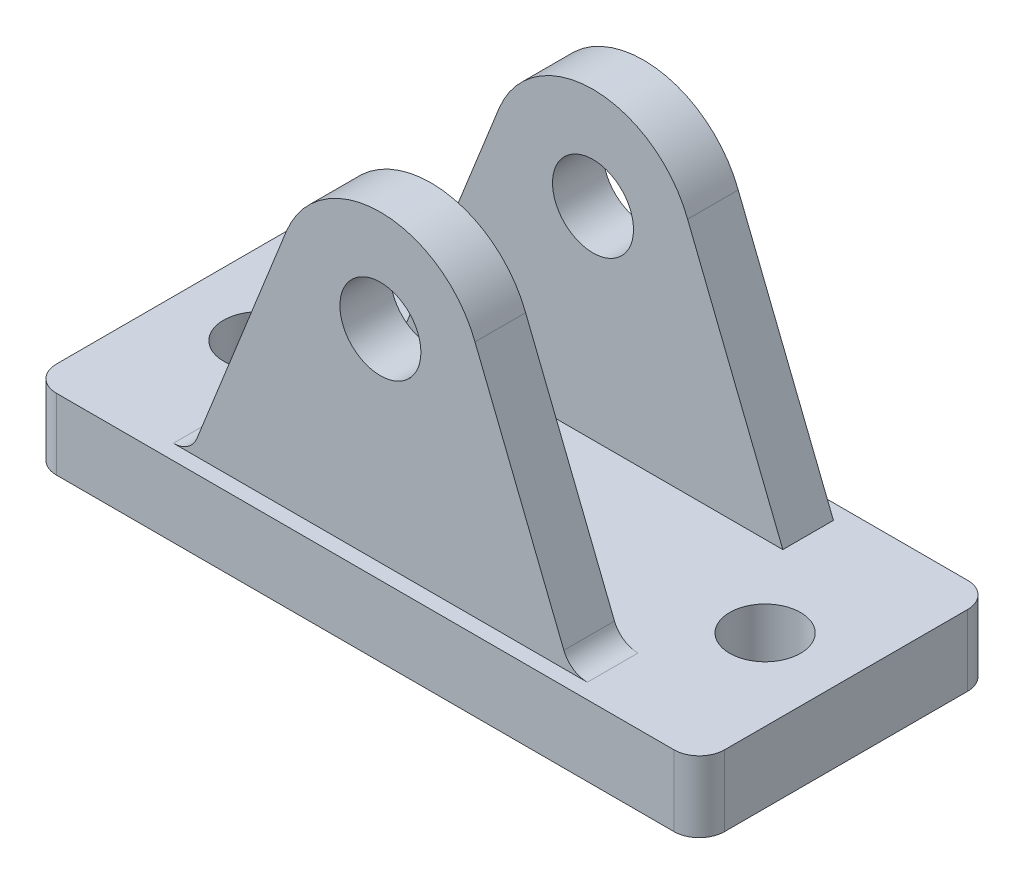
from build123d import *

# Parameters (mm, degrees)
IZIM1_R                     = 7
Y_KSEKLIK_EKSTR_ZYON1_DEPTH = 14
Y_KSEKLIK_EKSTR_ZYON3_START = -3
IZIM5_R                     = 8
Y_KSEKLIK_EKSTR_ZYON3_DEPTH = 10
RADYUS1_R                   = 5
L_O_ALTMA1_COUNT            = 2
L_O_ALTMA1_PITCH            = 42


with BuildPart() as part:
    # Çizim1 → Yükseklik-Ekstrüzyon1 (new body)
    with BuildSketch(Plane(origin=(0, 0, 0), x_dir=(1, 0, 0), z_dir=(0, 1, 0))):
        with BuildLine():
            Line((-135.225806452, 45.403225806), (-13.225806452, 45.403225806))
            ThreePointArc((-13.225806452, 45.403225806), (-9.690272546, 43.938759712), (-8.225806452, 40.403225806))
            Line((-8.225806452, 40.403225806), (-8.225806452, -7.596774194))
            ThreePointArc((-8.225806452, -7.596774194), (-9.690272546, -11.132308099), (-13.225806452, -12.596774194))
            Line((-13.225806452, -12.596774194), (-135.225806452, -12.596774194))
            ThreePointArc((-135.225806452, -12.596774194), (-138.761340358, -11.132308099), (-140.225806452, -7.596774194))
            Line((-140.225806452, -7.596774194), (-140.225806452, 40.403225806))
            ThreePointArc((-140.225806452, 40.403225806), (-138.761340358, 43.938759712), (-135.225806452, 45.403225806))
        make_face()
        with Locations(Location((-124.225806452, 16.403225806, 0), (0, 0, 270))):
            Circle(IZIM1_R, mode=Mode.SUBTRACT)
        with Locations(Location((-24.225806452, 16.403225806, 0), (0, 0, 270))):
            Circle(IZIM1_R, mode=Mode.SUBTRACT)
    extrude(amount=Y_KSEKLIK_EKSTR_ZYON1_DEPTH)

    # Çizim5 → Yükseklik-Ekstrüzyon3 (add)
    with BuildSketch(Plane.XY.offset(12.596774194).offset(Y_KSEKLIK_EKSTR_ZYON3_START)):
        with BuildLine():
            ThreePointArc((-55.536681856, 61.121560352), (-74.068812399, 73.999383812), (-92.800827063, 61.414081823))
            Line((-92.800827063, 61.414081823), (-111.725806452, 14))
            Line((-111.725806452, 14), (-36.725806452, 14))
            Line((-36.725806452, 14), (-55.536681856, 61.121560352))
        make_face()
        with Locations((-74.225806452, 54)):
            Circle(IZIM5_R, mode=Mode.SUBTRACT)
    y_kseklik_ekstr_zyon3 = extrude(amount=-Y_KSEKLIK_EKSTR_ZYON3_DEPTH)

    # Radyus1
    radyus1_edges = [part.edges().sort_by_distance(p)[0] for p in [
        (-36.725806452, 14, 4.596774194),
        (-111.725806452, 14, 4.596774194),
    ]]
    fillet(radyus1_edges, radius=RADYUS1_R)

    # LÇoğaltma1: Yükseklik-Ekstrüzyon3 ×2
    with Locations(*[(0, 0, -i * L_O_ALTMA1_PITCH) for i in range(1, L_O_ALTMA1_COUNT)]):
        add(y_kseklik_ekstr_zyon3)


solid = part.part
